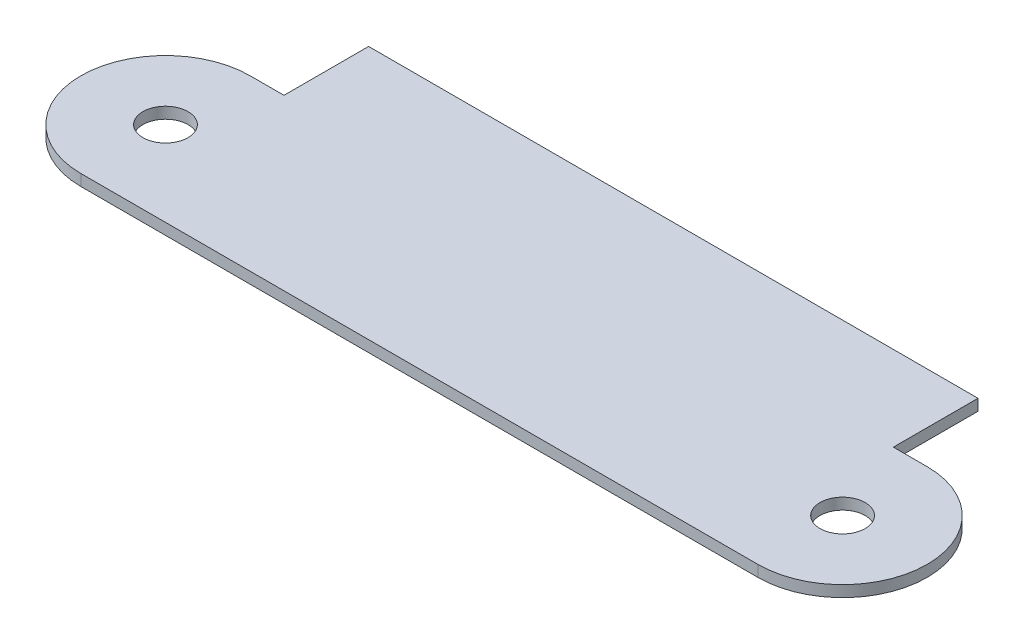
from build123d import *

# Parameters (mm, degrees)
SKETCH1_R           = 2
BOSS_EXTRUDE1_DEPTH = 1


with BuildPart() as part:
    # Sketch1 → Boss-Extrude1 (new body)
    with BuildSketch(Plane(origin=(0, 0, 0), x_dir=(1, 0, 0), z_dir=(0, 1, 0))):
        with BuildLine():
            ThreePointArc((60, 7.5), (67.5, 0), (60, -7.5))
            Line((60, -7.5), (0, -7.5))
            ThreePointArc((0, -7.5), (-7.5, 0), (0, 7.5))
            Line((0, 7.5), (3, 7.5))
            Line((3, 7.5), (3, 15))
            Line((3, 15), (57, 15))
            Line((57, 15), (57, 7.5))
            Line((57, 7.5), (60, 7.5))
        make_face()
        with Locations(Location((60, 0, 0), (0, 0, 270))):
            Circle(SKETCH1_R, mode=Mode.SUBTRACT)
        with Locations(Location((0, 0, 0), (0, 0, 270))):
            Circle(SKETCH1_R, mode=Mode.SUBTRACT)
    extrude(amount=BOSS_EXTRUDE1_DEPTH)


solid = part.part
